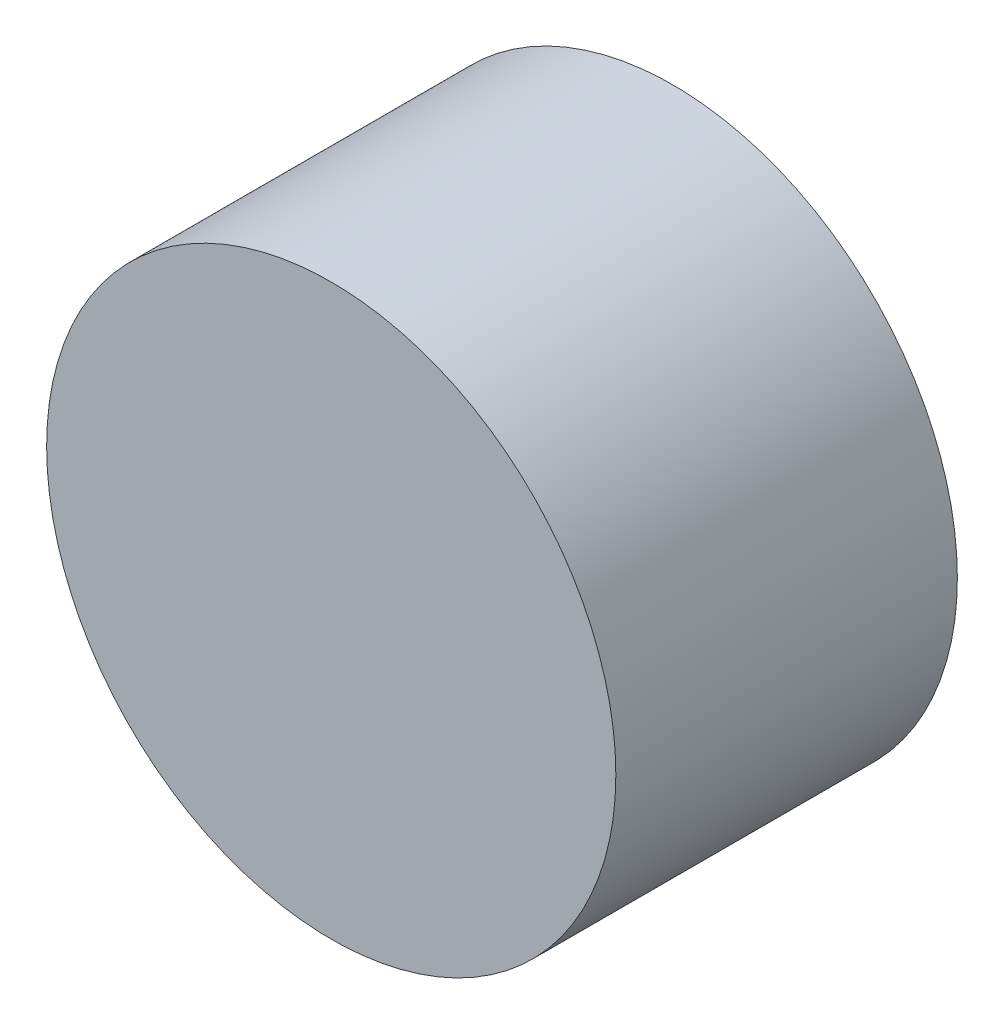
from build123d import *

# Parameters (mm, degrees)
ESQUISSE1_R        = 10
BOSS_EXTRU_1_DEPTH = 12


with BuildPart() as part:
    # Esquisse1 → Boss.-Extru.1 (new body)
    with BuildSketch(Plane.XY):
        Circle(ESQUISSE1_R)
    extrude(amount=BOSS_EXTRU_1_DEPTH)


solid = part.part
